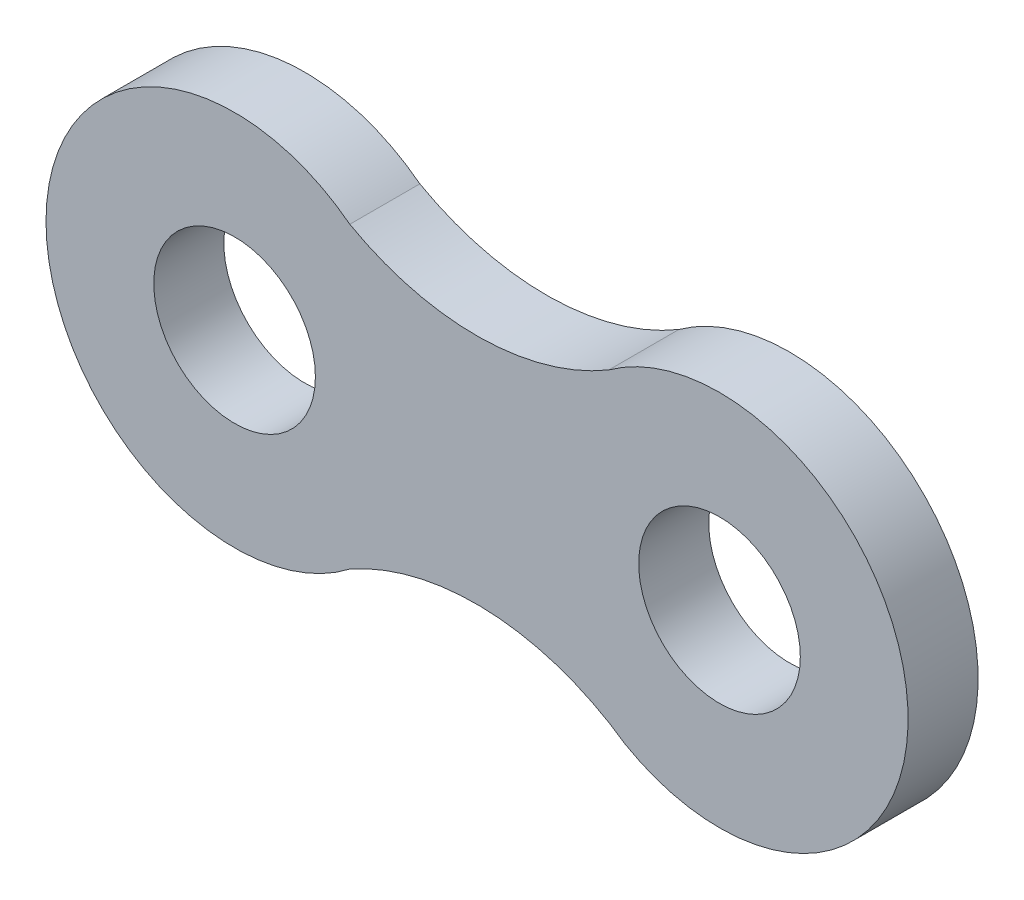
from build123d import *

# Parameters (mm, degrees)
SKETCH_1_R      = 1.5
EXTRUDE_1_DEPTH = 1.3


with BuildPart() as part:
    # 草图1 → 拉伸1 (new body)
    with BuildSketch(Plane.XY):
        with BuildLine():
            ThreePointArc((-42.678452475, 2.770643562), (-48.317034774, 0), (-42.678452475, -2.770643562))
            ThreePointArc((-42.678452475, -2.770643562), (-40.084683661, -2.163179112), (-37.566235472, -3.03155025))
            ThreePointArc((-37.566235472, -3.03155025), (-32.321750953, 0.181634277), (-37.871037472, 2.833914769))
            ThreePointArc((-37.871037472, 2.833914769), (-40.26625699, 2.157352959), (-42.678452475, 2.770643562))
        make_face()
        with Locations((-35.817034774, 0)):
            Circle(SKETCH_1_R, mode=Mode.SUBTRACT)
        with Locations((-44.817034774, 0)):
            Circle(SKETCH_1_R, mode=Mode.SUBTRACT)
    extrude(amount=EXTRUDE_1_DEPTH)


solid = part.part
